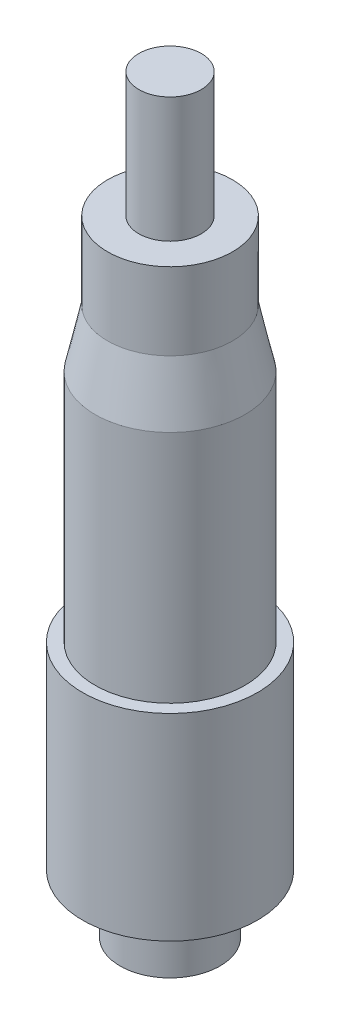
from build123d import *


with BuildPart() as part:
    # Sketch1 → Revolve1 (revolve)
    with BuildSketch(Plane.XY, mode=Mode.PRIVATE) as revolve1_sk:
        Polygon((0, 60), (2.5, 60), (2.5, 50), (5, 50), (5, 43.819095477), (6, 39.221105528), (6, 20.452261307), (7, 20.452261307), (7, 4.673366834), (4, 4.673366834), (4, 0), (0, 0), align=None)
    revolve(revolve1_sk.sketch.rotate(Axis((0, 0, 0), (0, 1, 0)), 90), axis=Axis((0, 0, 0), (0, 1, 0)))


solid = part.part
